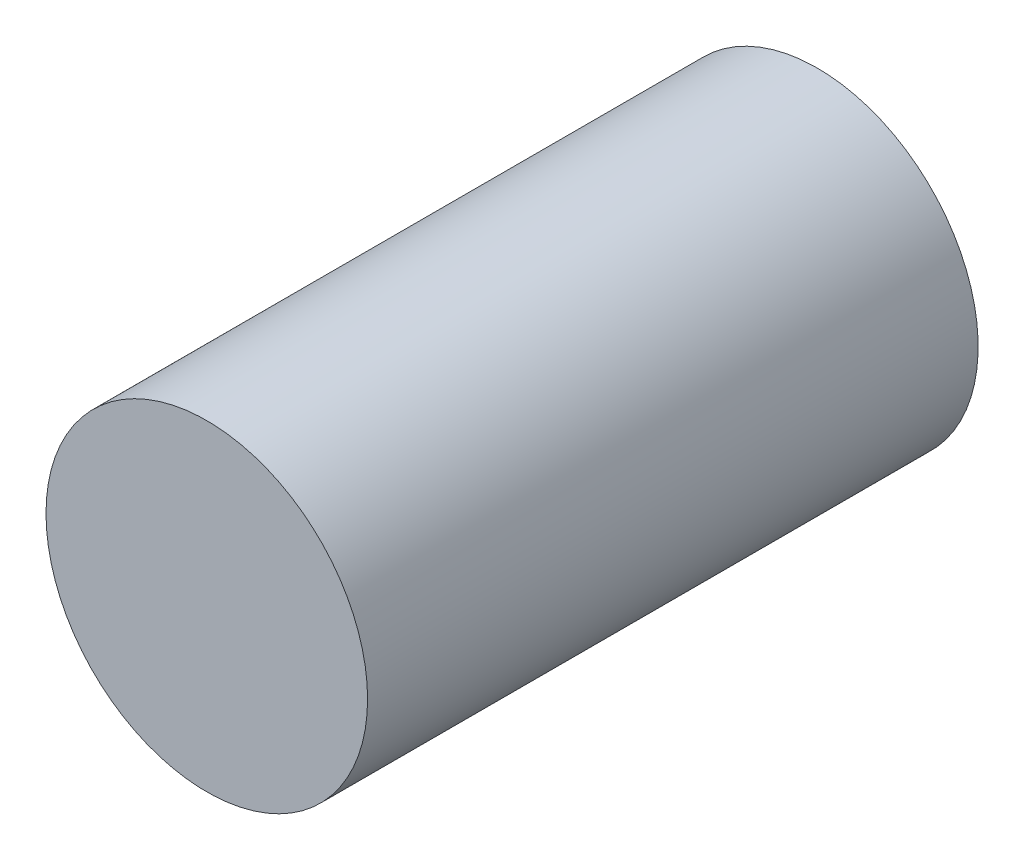
from build123d import *

# Parameters (mm, degrees)
ESQUISSE1_W        = 6.35
ESQUISSE1_H        = 298.45
BOSS_EXTRU_1_START = 15
ESQUISSE2_R        = 82.55
BOSS_EXTRU_1_DEPTH = 15


with BuildPart() as part:
    # Esquisse1 → Révolution1 (revolve)
    with BuildSketch(Plane.XZ, mode=Mode.PRIVATE) as r_volution1_sk:
        with Locations((79.375, 0)):
            Rectangle(ESQUISSE1_W, ESQUISSE1_H)
    revolve(r_volution1_sk.sketch.rotate(Axis((0, 0, 149.225), (0, 0, -1)), 180), axis=Axis((0, 0, 149.225), (0, 0, -1)))

    # Esquisse2 → Boss.-Extru.1 (add)
    with BuildSketch(Plane.XY.offset(149.225).offset(BOSS_EXTRU_1_START)):
        with Locations(Location((0, 0, 0), (0, 0, 180))):
            Circle(ESQUISSE2_R)
    extrude(amount=-BOSS_EXTRU_1_DEPTH)


solid = part.part
